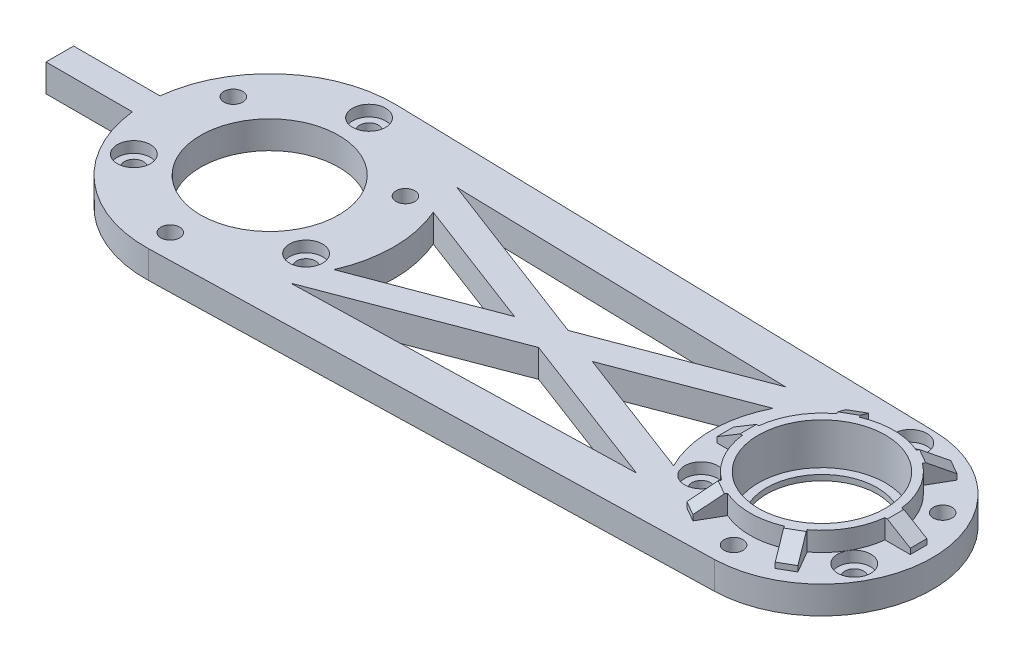
from build123d import *

# Parameters (mm, degrees)
SKETCH1_R                     = 22.5
SKETCH1_R_2                   = 12.5
SKETCH1_R_3                   = 1.7
SKETCH1_R_4                   = 20
SKETCH1_R_5                   = 11.5
BOSS_EXTRUDE1_DEPTH           = 5
SKETCH2_R                     = 3
CUT_EXTRUDE1_DEPTH            = 2
SKETCH3_R                     = 13
SKETCH3_R_2                   = 11.5
BOSS_EXTRUDE2_DEPTH           = 3.5
SKETCH4_R                     = 11.5
SKETCH4_R_2                   = 10
BOSS_EXTRUDE3_DEPTH           = 1
BOSS_EXTRUDE4_DEPTH           = 3.5
CHAMFER1_SIZE                 = 2.5
CHAMFER1_SIZE2                = 4.160698706
CIRPATTERN1_COUNT             = 6
CHAMFER1_OF_CIRPATTERN1_SIZE2 = 2.5
CHAMFER1_OF_CIRPATTERN1_SIZE  = 4.160698706
SKETCH7_W                     = 16
SKETCH7_H                     = 5
BOSS_EXTRUDE5_DEPTH           = 5


with BuildPart() as part:
    # Sketch1 → Boss-Extrude1 (new body)
    # profile 1 of 9: a face of its own
    with BuildSketch(Plane(origin=(0, 0, 0), x_dir=(1, 0, 0), z_dir=(0, 1, 0))):
        Circle(SKETCH1_R)
        with Locations(Location((0, 0, 0), (0, 0, 270))):
            Circle(SKETCH1_R_2, mode=Mode.SUBTRACT)
        with Locations(Location((-15.588457268, 9, 0), (0, 0, 270))):
            Circle(SKETCH1_R_3, mode=Mode.SUBTRACT)
        with Locations(Location((-15.588457268, -9, 0), (0, 0, 270))):
            Circle(SKETCH1_R_3, mode=Mode.SUBTRACT)
        with Locations(Location((0, -18, 0), (0, 0, 270))):
            Circle(SKETCH1_R_3, mode=Mode.SUBTRACT)
        with Locations(Location((15.588457268, -9, 0), (0, 0, 270))):
            Circle(SKETCH1_R_3, mode=Mode.SUBTRACT)
        with Locations(Location((15.588457268, 9, 0), (0, 0, 270))):
            Circle(SKETCH1_R_3, mode=Mode.SUBTRACT)
        with Locations(Location((0, 18, 0), (0, 0, 270))):
            Circle(SKETCH1_R_3, mode=Mode.SUBTRACT)
    # profile 2 of 9: a face of its own
    with BuildSketch(Plane(origin=(0, 0, 0), x_dir=(1, 0, 0), z_dir=(0, 1, 0))):
        with BuildLine():
            Line((100.5, 19.993749023), (0.5625, 22.492967651))
            ThreePointArc((0.5625, 22.492967651), (9.388247907, 20.447757854), (16.691908913, 15.087417832))
            Line((16.691908913, 15.087417832), (18.813128873, 15.034370753))
            Line((18.813128873, 15.034370753), (79.921396282, 13.506186436))
            Line((79.921396282, 13.506186436), (85.131066178, 13.375903969))
            ThreePointArc((85.131066178, 13.375903969), (92.090162259, 18.3693894), (100.5, 19.993749023))
        make_face()
    # profile 3 of 9: a face of its own
    with BuildSketch(Plane(origin=(0, 0, 0), x_dir=(1, 0, 0), z_dir=(0, 1, 0))):
        with BuildLine():
            Line((18.813128873, 15.034370753), (16.691908913, 15.087417832))
            ThreePointArc((16.691908913, 15.087417832), (18.903398529, 12.202930961), (20.621590627, 9))
            Line((20.621590627, 9), (44.334992825, 0))
            Line((44.334992825, 0), (51.380509764, 2.674000631))
            Line((51.380509764, 2.674000631), (18.813128873, 15.034370753))
        make_face()
    # profile 4 of 9: a face of its own
    with BuildSketch(Plane(origin=(0, 0, 0), x_dir=(1, 0, 0), z_dir=(0, 1, 0))):
        Polygon((58.426026703, 0), (51.380509764, 2.674000631), (44.334992825, 0), (51.380509764, -2.674000631), align=None)
    # profile 5 of 9: a face of its own
    with BuildSketch(Plane(origin=(0, 0, 0), x_dir=(1, 0, 0), z_dir=(0, 1, 0))):
        with BuildLine():
            ThreePointArc((82.139428901, 9), (83.489631833, 11.287503843), (85.131066178, 13.375903969))
            Line((85.131066178, 13.375903969), (79.921396282, 13.506186436))
            Line((79.921396282, 13.506186436), (51.380509764, 2.674000631))
            Line((51.380509764, 2.674000631), (58.426026703, 0))
            Line((58.426026703, 0), (82.139428901, 9))
        make_face()
    # profile 6 of 9: a face of its own
    with BuildSketch(Plane(origin=(0, 0, 0), x_dir=(1, 0, 0), z_dir=(0, 1, 0))):
        with BuildLine():
            Line((79.921396282, -13.506186436), (85.131066178, -13.375903969))
            ThreePointArc((85.131066178, -13.375903969), (83.489631833, -11.287503843), (82.139428901, -9))
            Line((82.139428901, -9), (58.426026703, 0))
            Line((58.426026703, 0), (51.380509764, -2.674000631))
            Line((51.380509764, -2.674000631), (79.921396282, -13.506186436))
        make_face()
    # profile 7 of 9: a face of its own
    with BuildSketch(Plane(origin=(0, 0, 0), x_dir=(1, 0, 0), z_dir=(0, 1, 0))):
        with BuildLine():
            ThreePointArc((20.621590627, -9), (18.903398529, -12.202930961), (16.691908913, -15.087417832))
            Line((16.691908913, -15.087417832), (18.813128873, -15.034370753))
            Line((18.813128873, -15.034370753), (51.380509764, -2.674000631))
            Line((51.380509764, -2.674000631), (44.334992825, 0))
            Line((44.334992825, 0), (20.621590627, -9))
        make_face()
    # profile 8 of 9: a face of its own
    with BuildSketch(Plane(origin=(0, 0, 0), x_dir=(1, 0, 0), z_dir=(0, 1, 0))):
        with BuildLine():
            ThreePointArc((16.691908913, -15.087417832), (9.388247907, -20.447757854), (0.5625, -22.492967651))
            Line((0.5625, -22.492967651), (100.5, -19.993749023))
            ThreePointArc((100.5, -19.993749023), (92.090162259, -18.3693894), (85.131066178, -13.375903969))
            Line((85.131066178, -13.375903969), (79.921396282, -13.506186436))
            Line((79.921396282, -13.506186436), (18.813128873, -15.034370753))
            Line((18.813128873, -15.034370753), (16.691908913, -15.087417832))
        make_face()
    # profile 9 of 9: a face of its own
    with BuildSketch(Plane(origin=(0, 0, 0), x_dir=(1, 0, 0), z_dir=(0, 1, 0))):
        with Locations((100, 0)):
            Circle(SKETCH1_R_4)
        with Locations(Location((86.143593539, 8, 0), (0, 0, 270))):
            Circle(SKETCH1_R_3, mode=Mode.SUBTRACT)
        with Locations(Location((86.143593539, -8, 0), (0, 0, 270))):
            Circle(SKETCH1_R_3, mode=Mode.SUBTRACT)
        with Locations(Location((100, -16, 0), (0, 0, 270))):
            Circle(SKETCH1_R_3, mode=Mode.SUBTRACT)
        with Locations(Location((113.856406461, -8, 0), (0, 0, 270))):
            Circle(SKETCH1_R_3, mode=Mode.SUBTRACT)
        with Locations(Location((113.856406461, 8, 0), (0, 0, 270))):
            Circle(SKETCH1_R_3, mode=Mode.SUBTRACT)
        with Locations(Location((100, 16, 0), (0, 0, 270))):
            Circle(SKETCH1_R_3, mode=Mode.SUBTRACT)
        with Locations(Location((100, 0, 0), (0, 0, 270))):
            Circle(SKETCH1_R_5, mode=Mode.SUBTRACT)
    extrude(amount=BOSS_EXTRUDE1_DEPTH)

    # Sketch2 → Cut-Extrude1 (cut)
    with BuildSketch(Plane(origin=(0, 5, 0), x_dir=(1, 0, 0), z_dir=(0, 1, 0))):
        with Locations(Location((0, 18, 0), (0, 0, 270))):
            Circle(SKETCH2_R)
        with Locations(Location((-15.588457268, -9, 0), (0, 0, 270))):
            Circle(SKETCH2_R)
        with Locations(Location((15.588457268, -9, 0), (0, 0, 270))):
            Circle(SKETCH2_R)
        with Locations(Location((100, 16, 0), (0, 0, 270))):
            Circle(SKETCH2_R)
        with Locations(Location((86.143593539, -8, 0), (0, 0, 270))):
            Circle(SKETCH2_R)
        with Locations(Location((113.856406461, -8, 0), (0, 0, 270))):
            Circle(SKETCH2_R)
    extrude(amount=-CUT_EXTRUDE1_DEPTH, mode=Mode.SUBTRACT)

    # Sketch3 → Boss-Extrude2 (add)
    with BuildSketch(Plane(origin=(0, 5, 0), x_dir=(1, 0, 0), z_dir=(0, 1, 0))):
        with Locations(Location((100, 0, 0), (0, 0, 90))):
            Circle(SKETCH3_R)
        with Locations(Location((100, 0, 0), (0, 0, 270))):
            Circle(SKETCH3_R_2, mode=Mode.SUBTRACT)
    extrude(amount=BOSS_EXTRUDE2_DEPTH)

    # Sketch4 → Boss-Extrude3 (add)
    with BuildSketch(Plane.XZ):
        with Locations(Location((100, 0, 0), (0, 0, 270))):
            Circle(SKETCH4_R)
        with Locations(Location((100, 0, 0), (0, 0, 270))):
            Circle(SKETCH4_R_2, mode=Mode.SUBTRACT)
    extrude(amount=-BOSS_EXTRUDE3_DEPTH)

    # Sketch6 → Boss-Extrude4 (add)
    with BuildSketch(Plane(origin=(0, 5, 0), x_dir=(1, 0, 0), z_dir=(0, 1, 0))):
        with BuildLine():
            Line((87.08682843, 1.5), (82.5, 1.5))
            Line((82.5, 1.5), (82.5, -1.5))
            Line((82.5, -1.5), (87.08682843, -1.5))
            ThreePointArc((87.08682843, -1.5), (87, 0), (87.08682843, 1.5))
        make_face()
    boss_extrude4 = extrude(amount=BOSS_EXTRUDE4_DEPTH)

    # Chamfer1
    chamfer1_edges = [part.edges().sort_by_distance(p)[0] for p in [
        (82.5, 8.5, 0),
    ]]
    chamfer1_side = [part.faces().sort_by_distance(p)[0] for p in [
        (82.5, 6.75, 0),
    ]]
    chamfer(chamfer1_edges, length=CHAMFER1_SIZE, length2=CHAMFER1_SIZE2, reference=chamfer1_side[0])

    # CirPattern1: Boss-Extrude4 ×6 about axis
    cirpattern1_axis = Axis((100, 0, 0), (0, 1, 0))
    for i in range(1, CIRPATTERN1_COUNT):
        add(boss_extrude4.rotate(cirpattern1_axis, i * 360 / CIRPATTERN1_COUNT))

    # Chamfer1 of CirPattern1
    chamfer1_of_cirpattern1_edges = [part.edges().sort_by_distance(p)[0] for p in [
        (91.25, 8.5, 15.155444566),
        (108.75, 8.5, 15.155444566),
        (117.5, 8.5, 0),
        (108.75, 8.5, -15.155444566),
        (91.25, 8.5, -15.155444566),
    ]]
    chamfer(chamfer1_of_cirpattern1_edges, length=CHAMFER1_OF_CIRPATTERN1_SIZE, length2=CHAMFER1_OF_CIRPATTERN1_SIZE2)

    # Sketch7 → Boss-Extrude5 (add)
    with BuildSketch(Plane.XZ):
        with Locations((-30, 0)):
            Rectangle(SKETCH7_W, SKETCH7_H)
    extrude(amount=-BOSS_EXTRUDE5_DEPTH)


solid = part.part
